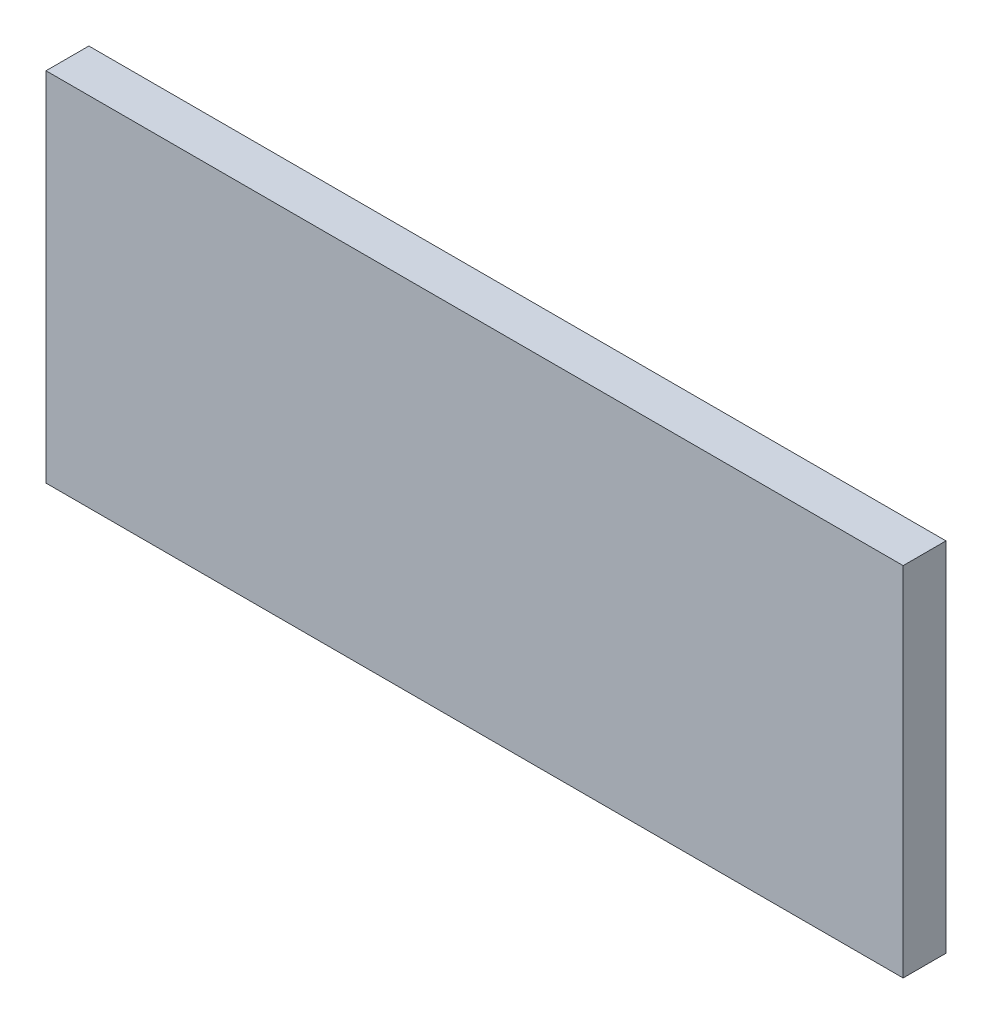
from build123d import *

# Parameters (mm, degrees)
SKETCH1_W           = 60
SKETCH1_H           = 25
BOSS_EXTRUDE1_DEPTH = 3


with BuildPart() as part:
    # Sketch1 → Boss-Extrude1 (new body)
    with BuildSketch(Plane.XY):
        Rectangle(SKETCH1_W, SKETCH1_H)
    extrude(amount=BOSS_EXTRUDE1_DEPTH)


solid = part.part
